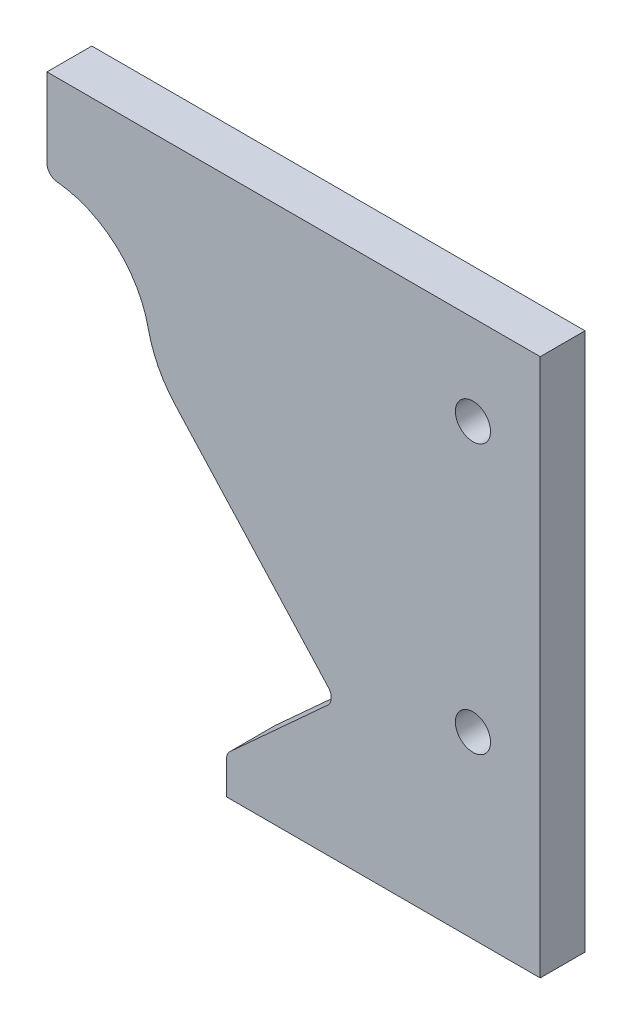
from build123d import *

# Parameters (mm, degrees)
SKETCH1_R           = 2.4892
BOSS_EXTRUDE1_DEPTH = 3.175
FILLET1_R           = 1.5875


with BuildPart() as part:
    # Sketch1 → Boss-Extrude1 (new, symmetric)
    with BuildSketch(Plane.XY):
        with BuildLine():
            Line((0, 27.3812), (69.85, 27.3812))
            Line((69.85, 27.3812), (69.85, -48.8188))
            Line((69.85, -48.8188), (25.42603388, -48.8188))
            Line((25.42603388, -48.8188), (25.42603388, -43.459816684))
            Line((25.42603388, -43.459816684), (40.915153964, -29.346022579))
            Line((40.915153964, -29.346022579), (18.162007104, -4.375683536))
            ThreePointArc((18.162007104, -4.375683536), (15.768494782, -0.923849067), (14.364087476, 3.034901057))
            ThreePointArc((14.364087476, 3.034901057), (9.246124703, 11.403806883), (0, 14.6812))
            Line((0, 14.6812), (0, 27.3812))
        make_face()
        with Locations((60.325, -23.4188)):
            Circle(SKETCH1_R, mode=Mode.SUBTRACT)
        with Locations((60.325, 14.6812)):
            Circle(SKETCH1_R, mode=Mode.SUBTRACT)
    extrude(amount=BOSS_EXTRUDE1_DEPTH, both=True)

    # Fillet1
    fillet1_edges = [part.edges().sort_by_distance(p)[0] for p in [
        (25.42603388, -43.459816684, 0),
        (40.915153964, -29.346022579, 0),
        (0, 14.6812, 0),
    ]]
    fillet(fillet1_edges, radius=FILLET1_R)


solid = part.part
